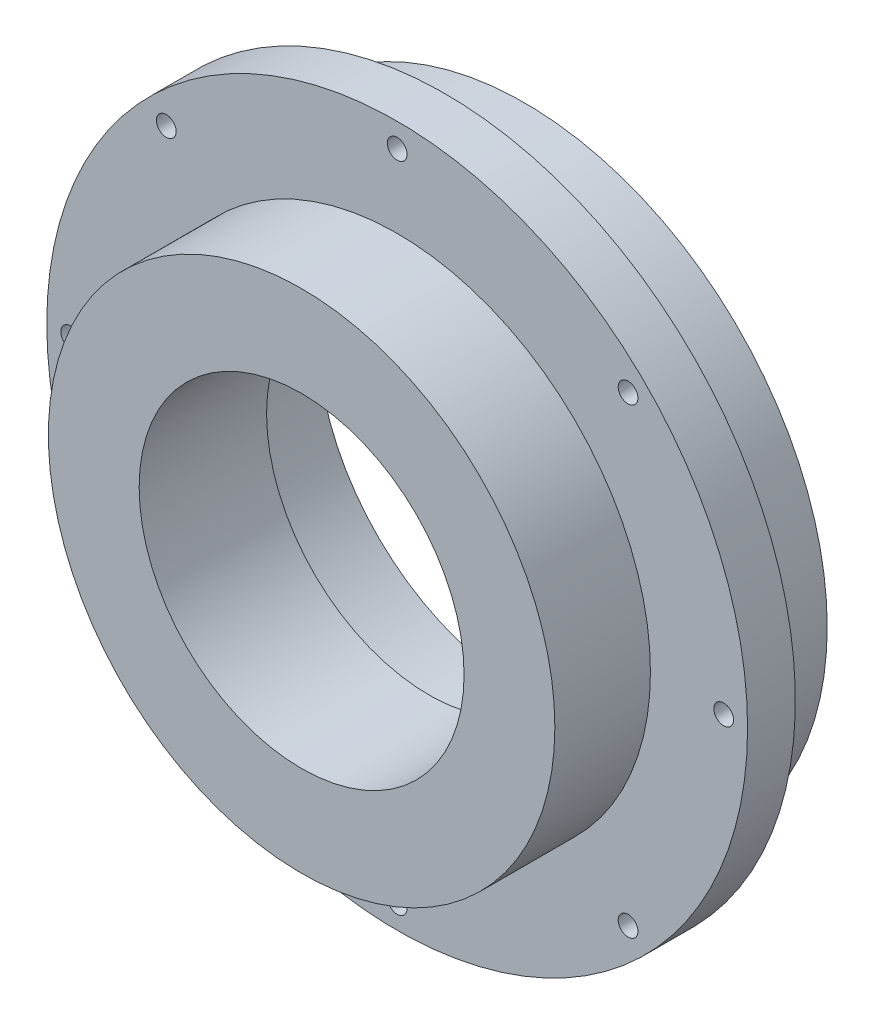
from build123d import *

# Parameters (mm, degrees)
IZIM1_R                     = 55
Y_KSEKLIK_EKSTR_ZYON1_DEPTH = 10
IZIM2_OUTSIDE_W             = 143.368
IZIM2_OUTSIDE_H             = 143.368
IZIM2_OUTSIDE_R             = 47.5
KES_EKSTR_ZYON1_DEPTH       = 12.5
IZIM3_R                     = 1.55
KES_EKSTR_ZYON2_DEPTH       = 79.779756283
DAIRESEL_KAPLAMA1_COUNT     = 8
IZIM5_R                     = 32.525
KES_EKSTR_ZYON3_DEPTH       = 15
IZIM6_R                     = 25.5
KES_EKSTR_ZYON4_DEPTH       = 80.214897589
IZIM7_R                     = 39.75
IZIM7_R_2                   = 25.5
Y_KSEKLIK_EKSTR_ZYON2_DEPTH = 15
IZIM8_R                     = 1.5
IZIM8_R_2                   = 1.464466486
KES_EKSTR_ZYON5_DEPTH       = 12.5


with BuildPart() as part:
    # Çizim1 → Yükseklik-Ekstrüzyon1 (new, symmetric)
    with BuildSketch(Plane.XY):
        Circle(IZIM1_R)
    extrude(amount=Y_KSEKLIK_EKSTR_ZYON1_DEPTH, both=True)

    # Çizim2 outside → Kes-Ekstrüzyon1 (cut)
    with BuildSketch(Plane(origin=(0, 0, -10), x_dir=(-1, 0, 0), z_dir=(0, 0, -1))):
        Rectangle(IZIM2_OUTSIDE_W, IZIM2_OUTSIDE_H)
        Circle(IZIM2_OUTSIDE_R, mode=Mode.SUBTRACT)
    extrude(amount=-KES_EKSTR_ZYON1_DEPTH, mode=Mode.SUBTRACT)

    # Çizim3 → Kes-Ekstrüzyon2 (cut, through all)
    with BuildSketch(Plane(origin=(0, 0, 2.5), x_dir=(-1, 0, 0), z_dir=(0, 0, -1))):
        with Locations((0, 51.25)):
            Circle(IZIM3_R)
    kes_ekstr_zyon2 = extrude(amount=-KES_EKSTR_ZYON2_DEPTH, mode=Mode.SUBTRACT)

    # Dairesel Kaplama1: Kes-Ekstrüzyon2 ×8 about axis
    dairesel_kaplama1_axis = Axis((0, 0, 0), (0, 0, 1))
    for i in range(1, DAIRESEL_KAPLAMA1_COUNT):
        add(kes_ekstr_zyon2.rotate(dairesel_kaplama1_axis, i * 360 / DAIRESEL_KAPLAMA1_COUNT), mode=Mode.SUBTRACT)

    # Çizim5 → Kes-Ekstrüzyon3 (cut)
    with BuildSketch(Plane(origin=(0, 0, -10), x_dir=(-1, 0, 0), z_dir=(0, 0, -1))):
        Circle(IZIM5_R)
    extrude(amount=-KES_EKSTR_ZYON3_DEPTH, mode=Mode.SUBTRACT)

    # Çizim6 → Kes-Ekstrüzyon4 (cut, through all)
    with BuildSketch(Plane(origin=(0, 0, 5), x_dir=(-1, 0, 0), z_dir=(0, 0, -1))):
        Circle(IZIM6_R)
    extrude(amount=-KES_EKSTR_ZYON4_DEPTH, mode=Mode.SUBTRACT)

    # Çizim7 → Yükseklik-Ekstrüzyon2 (add)
    with BuildSketch(Plane.XY.offset(10)):
        Circle(IZIM7_R)
        with Locations(Location((0, 0, 0), (0, 0, 180))):
            Circle(IZIM7_R_2, mode=Mode.SUBTRACT)
    extrude(amount=Y_KSEKLIK_EKSTR_ZYON2_DEPTH)

    # Çizim8 → Kes-Ekstrüzyon5 (cut)
    with BuildSketch(Plane(origin=(0, 0, -10), x_dir=(-1, 0, 0), z_dir=(0, 0, -1))):
        with Locations((16.264045876, -39.264880132)):
            Circle(IZIM8_R)
        with Locations((39.264880132, -16.264045876)):
            Circle(IZIM8_R)
        with Locations((-16.264045876, -39.264880132)):
            Circle(IZIM8_R_2)
        with Locations((-39.264880132, -16.264045876)):
            Circle(IZIM8_R)
        with Locations((39.264880132, 16.264045876)):
            Circle(IZIM8_R)
        with Locations((16.264045876, 39.264880132)):
            Circle(IZIM8_R)
        with Locations((-16.264045876, 39.264880132)):
            Circle(IZIM8_R)
        with Locations((-39.264880132, 16.264045876)):
            Circle(IZIM8_R)
    extrude(amount=-KES_EKSTR_ZYON5_DEPTH, mode=Mode.SUBTRACT)


solid = part.part
